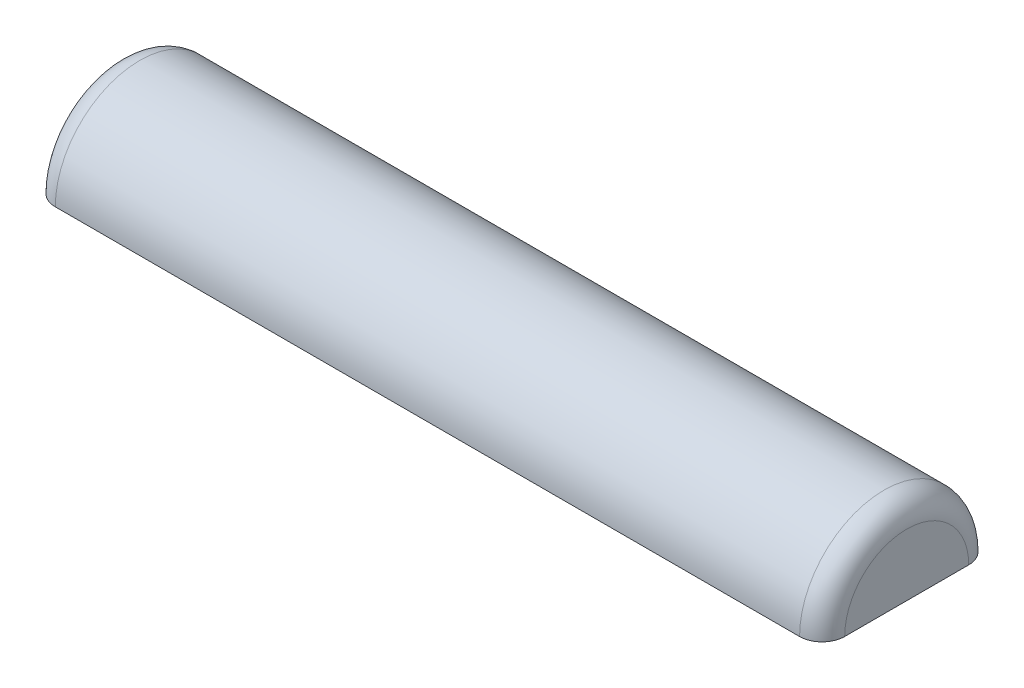
from build123d import *

# Parameters (mm, degrees)
BOSS_EXTRUDE1_DEPTH = 0.7
FILLET1_R           = 0.02


with BuildPart() as part:
    # Sketch1 → Boss-Extrude1 (new body)
    with BuildSketch(Plane(origin=(0, 0, 0), x_dir=(0, 0, -1), z_dir=(1, 0, 0))):
        with BuildLine():
            Line((0, 0), (0.15, 0))
            ThreePointArc((0.15, 0), (0.075, 0.075), (0, 0))
        make_face()
    extrude(amount=BOSS_EXTRUDE1_DEPTH)

    # Fillet1
    fillet1_edges = [part.edges().sort_by_distance(p)[0] for p in [
        (0, 0.075, -0.075),
        (0.7, 0.075, -0.075),
    ]]
    fillet(fillet1_edges, radius=FILLET1_R)


solid = part.part
